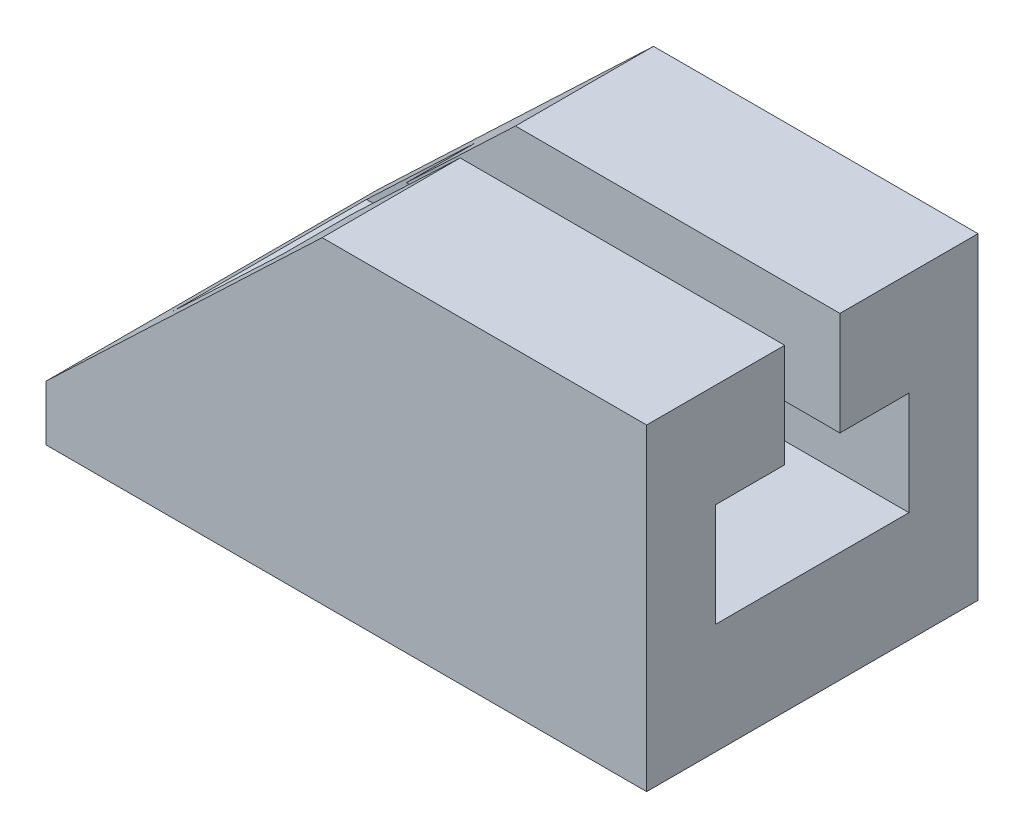
from build123d import *

# Parameters (mm, degrees)
SKETCH1_W               = 87
SKETCH1_H               = 48
BOSS_EXTRUDE1_DEPTH     = 46
CUT_EXTRUDE1_DEPTH      = 68.707089732
CUT_EXTRUDE1_DEPTH_BACK = 68.707089732
CUT_EXTRUDE2_DEPTH      = 68.707089732
CUT_EXTRUDE2_DEPTH_BACK = 68.707089732


with BuildPart() as part:
    # Sketch1 → Boss-Extrude1 (new body)
    with BuildSketch(Plane(origin=(0, 0, 0), x_dir=(1, 0, 0), z_dir=(0, 1, 0))):
        Rectangle(SKETCH1_W, SKETCH1_H)
    extrude(amount=BOSS_EXTRUDE1_DEPTH)

    # Sketch2 → Cut-Extrude1 (cut, two sides: drawn at the far end of the back side and taken through both)
    with BuildSketch(Plane(origin=(0, 0, 0), x_dir=(0, 0, -1), z_dir=(1, 0, 0)).offset(-CUT_EXTRUDE1_DEPTH_BACK)):
        Polygon((4, 31), (14, 31), (14, 16), (-14, 16), (-14, 31), (-4, 31), (-4, 46), (4, 46), align=None)
    extrude(amount=CUT_EXTRUDE1_DEPTH + CUT_EXTRUDE1_DEPTH_BACK, mode=Mode.SUBTRACT)

    # Sketch3 → Cut-Extrude2 (cut, two sides: drawn at the far end of the back side and taken through both)
    with BuildSketch(Plane.XY.offset(-CUT_EXTRUDE2_DEPTH_BACK)):
        Polygon((-43.5, 46), (-43.5, 8), (-3.5, 46), align=None)
    extrude(amount=CUT_EXTRUDE2_DEPTH + CUT_EXTRUDE2_DEPTH_BACK, mode=Mode.SUBTRACT)


solid = part.part
